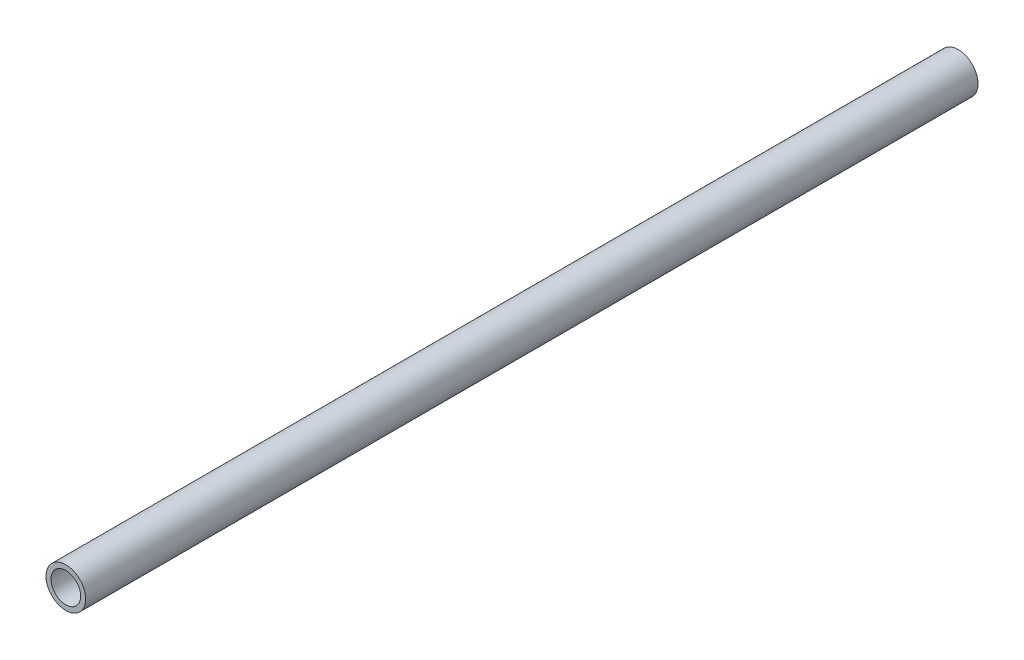
from build123d import *

# Parameters (mm, degrees)
IZIM1_R                     = 4
IZIM1_R_2                   = 3
Y_KSEKLIK_EKSTR_ZYON1_DEPTH = 180


with BuildPart() as part:
    # Çizim1 → Yükseklik-Ekstrüzyon1 (new body)
    with BuildSketch(Plane.XY):
        with Locations(Location((0, 0, 0), (0, 0, 180))):
            Circle(IZIM1_R)
        with Locations(Location((0, 0, 0), (0, 0, 180))):
            Circle(IZIM1_R_2, mode=Mode.SUBTRACT)
    extrude(amount=Y_KSEKLIK_EKSTR_ZYON1_DEPTH)


solid = part.part
